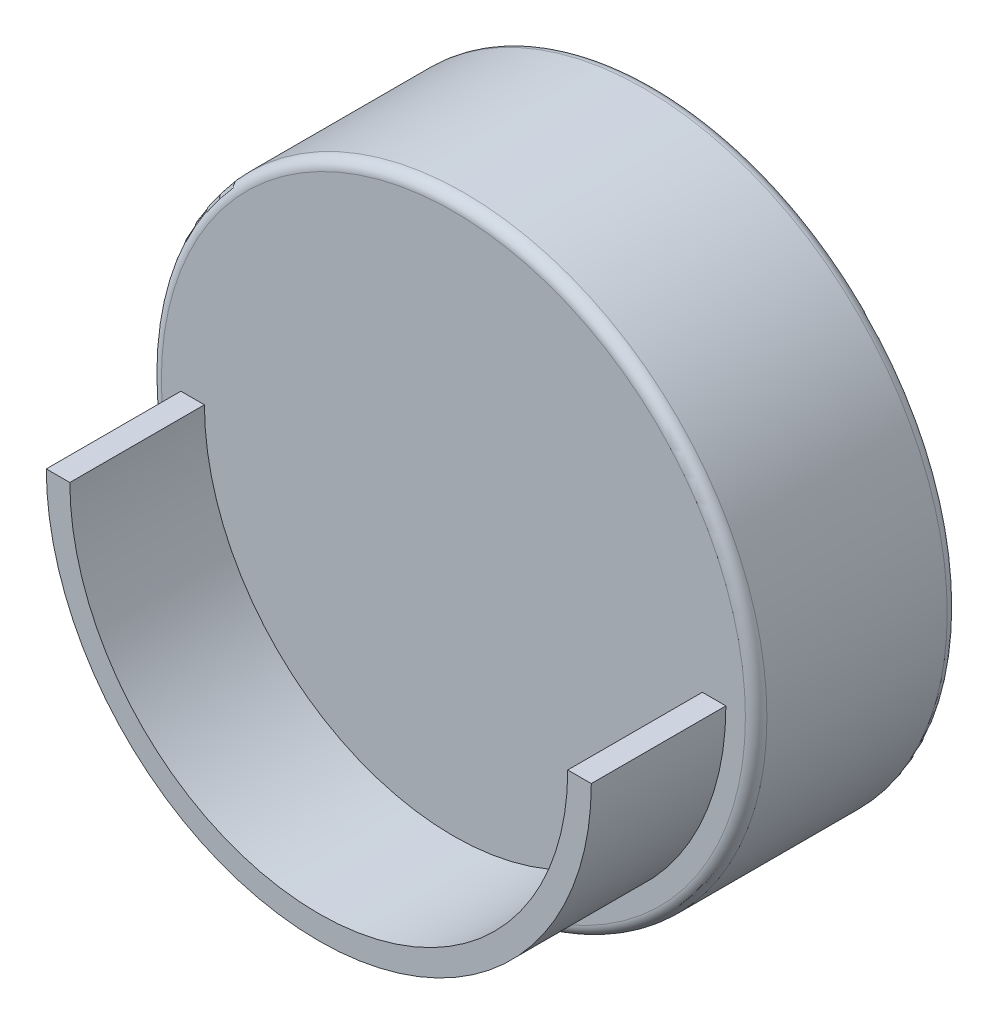
from build123d import *

# Parameters (mm, degrees)
SKETCH1_R               = 22.5
BOSS_EXTRUDE1_DEPTH     = 15
SKETCH2_R               = 20.25
SKETCH2_R_2             = 18.5
BOSS_EXTRUDE2_DEPTH     = 10
CUT_EXTRUDE1_DEPTH      = 41.466035141
CUT_EXTRUDE1_DEPTH_BACK = 41.466035141
SKETCH4_W               = 10
SKETCH4_H               = 24.752073401
FILLET1_R               = 0.8
SKETCH5_R               = 20.25
SKETCH5_R_2             = 12.5
CUT_EXTRUDE2_DEPTH      = 10


with BuildPart() as part:
    # Sketch1 → Boss-Extrude1 (new body)
    with BuildSketch(Plane.XY):
        Circle(SKETCH1_R)
    extrude(amount=BOSS_EXTRUDE1_DEPTH)

    # Sketch2 → Boss-Extrude2 (add)
    with BuildSketch(Plane.XY.offset(15)):
        Circle(SKETCH2_R)
        Circle(SKETCH2_R_2, mode=Mode.SUBTRACT)
    extrude(amount=BOSS_EXTRUDE2_DEPTH)

    # Sketch4 → Cut-Extrude1 (cut, two sides: drawn at the far end of the back side and taken through both)
    with BuildSketch(Plane(origin=(0, 0, 0), x_dir=(0, 0, -1), z_dir=(1, 0, 0)).offset(-CUT_EXTRUDE1_DEPTH_BACK)):
        with Locations((-20, 12.376036701)):
            Rectangle(SKETCH4_W, SKETCH4_H)
    extrude(amount=CUT_EXTRUDE1_DEPTH + CUT_EXTRUDE1_DEPTH_BACK, mode=Mode.SUBTRACT)

    # Fillet1
    fillet1_edges = [part.edges().sort_by_distance(p)[0] for p in [
        (-22.5, 0, 0),
        (-22.5, 0, 15),
    ]]
    fillet(fillet1_edges, radius=FILLET1_R)

    # Sketch5 → Cut-Extrude2 (cut)
    with BuildSketch(Plane(origin=(0, 0, 0), x_dir=(-1, 0, 0), z_dir=(0, 0, -1))):
        Circle(SKETCH5_R)
        Circle(SKETCH5_R_2, mode=Mode.SUBTRACT)
    extrude(amount=-CUT_EXTRUDE2_DEPTH, mode=Mode.SUBTRACT)


solid = part.part
